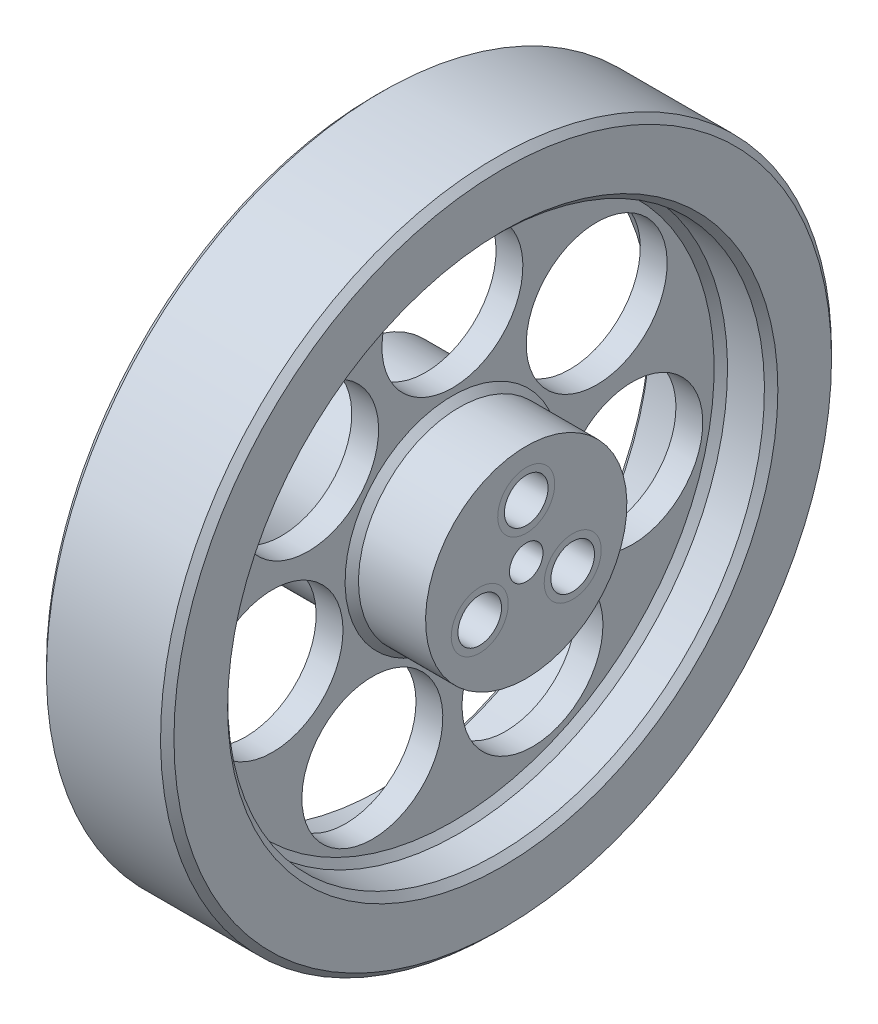
from build123d import *

# Parameters (mm, degrees)
PAH1_SIZE                     = 1
IZIM2_R                       = 10.5
KES_EKSTR_ZYON1_DEPTH         = 73.284161474
IZIM3_R                       = 4.25
KES_EKSTR_ZYON2_DEPTH         = 76.339232807
IZIM4_R                       = 4.25
IZIM4_R_2                     = 3.25
Y_KSEKLIK_EKSTR_ZYON2_DEPTH   = 26
Y_KSEKLIK_EKSTR_ZYON2_2_DEPTH = 26
Y_KSEKLIK_EKSTR_ZYON2_3_DEPTH = 26


with BuildPart() as part:
    # Çizim1 → Döndür1 (revolve)
    with BuildSketch(Plane.XY, mode=Mode.PRIVATE) as d_nd_r1_sk:
        Polygon((-13, 2.5), (13, 2.5), (13, 15), (2, 15), (2, 40), (9.5, 40), (9.5, 50), (-9.5, 50), (-9.5, 40), (-2, 40), (-2, 15), (-13, 15), align=None)
    revolve(d_nd_r1_sk.sketch.rotate(Axis((-43.259157892, 0, 0), (1, 0, 0)), 180), axis=Axis((-43.259157892, 0, 0), (1, 0, 0)))

    # Pah1
    pah1_edges = [part.edges().sort_by_distance(p)[0] for p in [
        (-2, 15, 0),
        (2, 15, 0),
        (2, 40, 0),
        (9.5, 40, 0),
        (9.5, 50, 0),
        (-9.5, 50, 0),
        (-9.5, 40, 0),
        (-2, 40, 0),
    ]]
    chamfer(pah1_edges, length=PAH1_SIZE)

    # Çizim2 → Kes-Ekstrüzyon1 (cut, through all)
    with BuildSketch(Plane.ZY.offset(2)):
        with Locations(Location((0, 27.5, 0), (0, 0, 270))):
            Circle(IZIM2_R)
        with Locations(Location((21.500365768, 17.145969551, 0), (0, 0, 270))):
            Circle(IZIM2_R)
        with Locations(Location((26.810517585, -6.119325684, 0), (0, 0, 270))):
            Circle(IZIM2_R)
        with Locations(Location((11.931802826, -24.776643867, 0), (0, 0, 270))):
            Circle(IZIM2_R)
        with Locations(Location((-11.931802826, -24.776643867, 0), (0, 0, 270))):
            Circle(IZIM2_R)
        with Locations(Location((-26.810517585, -6.119325684, 0), (0, 0, 270))):
            Circle(IZIM2_R)
        with Locations(Location((-21.500365768, 17.145969551, 0), (0, 0, 270))):
            Circle(IZIM2_R)
    extrude(amount=-KES_EKSTR_ZYON1_DEPTH, mode=Mode.SUBTRACT)

    # Çizim3 → Kes-Ekstrüzyon2 (cut, through all)
    with BuildSketch(Plane(origin=(13, 0, 0), x_dir=(0, 0, -1), z_dir=(1, 0, 0))):
        with Locations(Location((0, 8, 0), (0, 0, 90))):
            Circle(IZIM3_R)
        with Locations(Location((6.92820323, -4, 0), (0, 0, 90))):
            Circle(IZIM3_R)
        with Locations(Location((-6.92820323, -4, 0), (0, 0, 90))):
            Circle(IZIM3_R)
    extrude(amount=-KES_EKSTR_ZYON2_DEPTH, mode=Mode.SUBTRACT)


with BuildPart() as body_2:
    # Çizim4 → Yükseklik-Ekstrüzyon2 (new, through all)
    with BuildSketch(Plane(origin=(13, 0, 0), x_dir=(0, 0, -1), z_dir=(1, 0, 0))):
        with Locations(Location((-6.92820323, -4, 0), (0, 0, 90))):
            Circle(IZIM4_R)
        with Locations(Location((-6.92820323, -4, 0), (0, 0, 90))):
            Circle(IZIM4_R_2, mode=Mode.SUBTRACT)
    extrude(amount=-Y_KSEKLIK_EKSTR_ZYON2_DEPTH)


with BuildPart() as body_3:
    # Çizim4 → Y_kseklik-Ekstr_zyon2 2 (new, through all)
    with BuildSketch(Plane(origin=(13, 0, 0), x_dir=(0, 0, -1), z_dir=(1, 0, 0))):
        with Locations(Location((6.92820323, -4, 0), (0, 0, 90))):
            Circle(IZIM4_R)
        with Locations(Location((6.92820323, -4, 0), (0, 0, 90))):
            Circle(IZIM4_R_2, mode=Mode.SUBTRACT)
    extrude(amount=-Y_KSEKLIK_EKSTR_ZYON2_2_DEPTH)


with BuildPart() as body_4:
    # Çizim4 → Y_kseklik-Ekstr_zyon2 3 (new, through all)
    with BuildSketch(Plane(origin=(13, 0, 0), x_dir=(0, 0, -1), z_dir=(1, 0, 0))):
        with Locations(Location((0, 8, 0), (0, 0, 90))):
            Circle(IZIM4_R)
        with Locations(Location((0, 8, 0), (0, 0, 90))):
            Circle(IZIM4_R_2, mode=Mode.SUBTRACT)
    extrude(amount=-Y_KSEKLIK_EKSTR_ZYON2_3_DEPTH)


solid = Compound([part.part, body_2.part, body_3.part, body_4.part])
